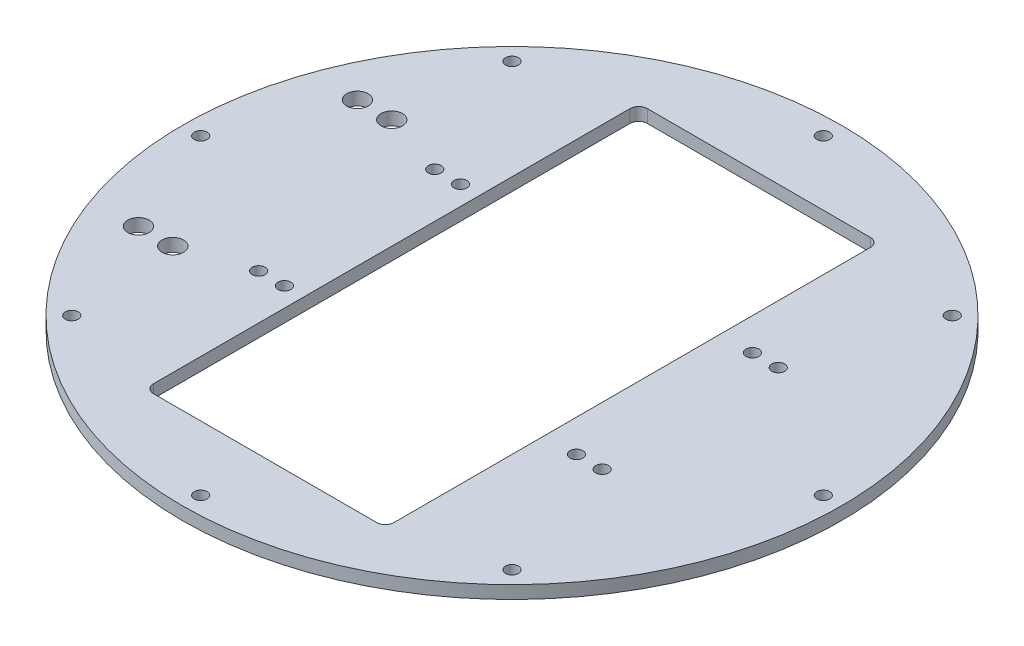
from build123d import *

# Parameters (mm, degrees)
SKETCH_1_R      = 76.75
SKETCH_1_R_2    = 1.5
SKETCH_1_R_3    = 2.5
SKETCH_1_W      = 56
SKETCH_1_H      = 115
EXTRUDE_1_DEPTH = 3
FILLET_1_R      = 2


with BuildPart() as part:
    # 草图1 → 凸台-拉伸1 (new body)
    with BuildSketch(Plane(origin=(0, 0, 0), x_dir=(1, 0, 0), z_dir=(0, 1, 0))):
        with Locations(Location((0, 0, 0), (0, 0, 270))):
            Circle(SKETCH_1_R)
        with Locations(Location((0, 72.5, 0), (0, 0, 270))):
            Circle(SKETCH_1_R_2, mode=Mode.SUBTRACT)
        with Locations(Location((51.265241636, 51.265241636, 0), (0, 0, 270))):
            Circle(SKETCH_1_R_2, mode=Mode.SUBTRACT)
        with Locations(Location((72.5, 0, 0), (0, 0, 270))):
            Circle(SKETCH_1_R_2, mode=Mode.SUBTRACT)
        with Locations(Location((51.265241636, -51.265241636, 0), (0, 0, 270))):
            Circle(SKETCH_1_R_2, mode=Mode.SUBTRACT)
        with Locations(Location((0, -72.5, 0), (0, 0, 270))):
            Circle(SKETCH_1_R_2, mode=Mode.SUBTRACT)
        with Locations(Location((-51.265241636, -51.265241636, 0), (0, 0, 270))):
            Circle(SKETCH_1_R_2, mode=Mode.SUBTRACT)
        with Locations(Location((-72.5, 0, 0), (0, 0, 270))):
            Circle(SKETCH_1_R_2, mode=Mode.SUBTRACT)
        with Locations(Location((-51.265241636, 51.265241636, 0), (0, 0, 270))):
            Circle(SKETCH_1_R_2, mode=Mode.SUBTRACT)
        with Locations(Location((-32.5, -20.5, 0), (0, 0, 270))):
            Circle(SKETCH_1_R_2, mode=Mode.SUBTRACT)
        with Locations(Location((-38.5, -20.5, 0), (0, 0, 270))):
            Circle(SKETCH_1_R_2, mode=Mode.SUBTRACT)
        with Locations(Location((-38.5, 20.5, 0), (0, 0, 270))):
            Circle(SKETCH_1_R_2, mode=Mode.SUBTRACT)
        with Locations(Location((-53.5, 25.5, 0), (0, 0, 270))):
            Circle(SKETCH_1_R_3, mode=Mode.SUBTRACT)
        with Locations(Location((-61.5, 25.5, 0), (0, 0, 270))):
            Circle(SKETCH_1_R_3, mode=Mode.SUBTRACT)
        with Locations(Location((-53.5, -25.5, 0), (0, 0, 90))):
            Circle(SKETCH_1_R_3, mode=Mode.SUBTRACT)
        with Locations(Location((-61.5, -25.5, 0), (0, 0, 90))):
            Circle(SKETCH_1_R_3, mode=Mode.SUBTRACT)
        with Locations(Location((-32.5, 20.5, 0), (0, 0, 270))):
            Circle(SKETCH_1_R_2, mode=Mode.SUBTRACT)
        with Locations(Location((35.5, 20.5, 0), (0, 0, 270))):
            Circle(SKETCH_1_R_2, mode=Mode.SUBTRACT)
        with Locations(Location((41.5, 20.5, 0), (0, 0, 270))):
            Circle(SKETCH_1_R_2, mode=Mode.SUBTRACT)
        with Locations(Location((35.5, -20.5, 0), (0, 0, 270))):
            Circle(SKETCH_1_R_2, mode=Mode.SUBTRACT)
        with Locations(Location((41.5, -20.5, 0), (0, 0, 270))):
            Circle(SKETCH_1_R_2, mode=Mode.SUBTRACT)
        Rectangle(SKETCH_1_W, SKETCH_1_H, mode=Mode.SUBTRACT)
    extrude(amount=EXTRUDE_1_DEPTH)

    # 圆角1
    fillet_1_edges = [part.edges().sort_by_distance(p)[0] for p in [
        (28, 1.5, 57.5),
        (28, 1.5, -57.5),
        (-28, 1.5, -57.5),
        (-28, 1.5, 57.5),
    ]]
    fillet(fillet_1_edges, radius=FILLET_1_R)


solid = part.part
